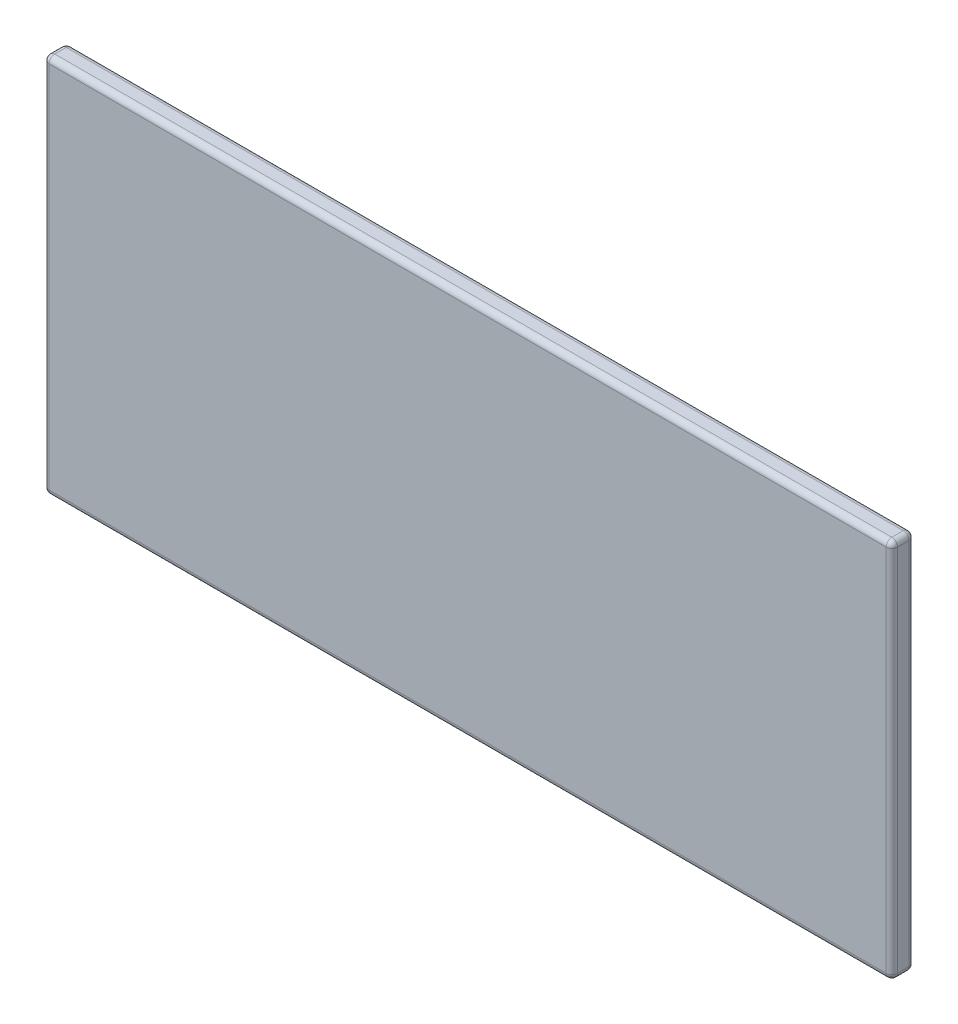
from build123d import *

# Parameters (mm, degrees)
SKETCH1_W           = 74.7
SKETCH1_H           = 33.5
BOSS_EXTRUDE1_DEPTH = 2
FILLET1_R           = 0.5


with BuildPart() as part:
    # Sketch1 → Boss-Extrude1 (new body)
    with BuildSketch(Plane.XY):
        Rectangle(SKETCH1_W, SKETCH1_H)
    extrude(amount=BOSS_EXTRUDE1_DEPTH)

    # Fillet1
    fillet1_edges = [part.edges().sort_by_distance(p)[0] for p in [
        (-37.35, 0, 2),
        (0, -16.75, 2),
        (37.35, 0, 2),
        (0, -16.75, 0),
        (-37.35, 0, 0),
        (0, 16.75, 0),
        (37.35, 0, 0),
        (37.35, -16.75, 1),
        (-37.35, -16.75, 1),
        (-37.35, 16.75, 1),
        (37.35, 16.75, 1),
        (0, 16.75, 2),
    ]]
    fillet(fillet1_edges, radius=FILLET1_R)


solid = part.part
